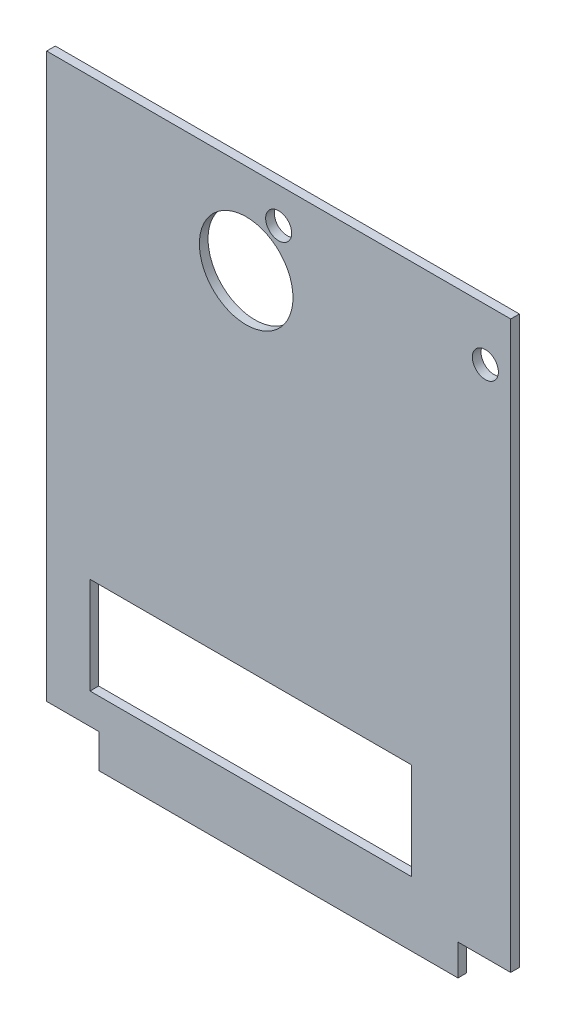
from build123d import *

# Parameters (mm, degrees)
SKETCH1_W           = 81.534
SKETCH1_H           = 104.902
BOSS_EXTRUDE1_DEPTH = 1.524
SKETCH2_W           = 9.17
SKETCH2_H           = 5.95
SKETCH2_W_2         = 9.266089767
SKETCH2_H_2         = 5.472
CUT_EXTRUDE1_DEPTH  = 1.524
SKETCH4_W           = 56.5
SKETCH4_H           = 17
CUT_EXTRUDE2_DEPTH  = 1.524
SKETCH6_R           = 2.285
CUT_EXTRUDE3_DEPTH  = 1.524
SKETCH8_R           = 8.224077239
CUT_EXTRUDE4_DEPTH  = 2.54


with BuildPart() as part:
    # Sketch1 → Boss-Extrude1 (new body)
    with BuildSketch(Plane.XY):
        with Locations((-2.046973799, -6.087681223)):
            Rectangle(SKETCH1_W, SKETCH1_H)
    extrude(amount=BOSS_EXTRUDE1_DEPTH)

    # Sketch2 → Cut-Extrude1 (cut)
    with BuildSketch(Plane.XY.offset(1.524)):
        with Locations((-38.228973799, -55.563681223)):
            Rectangle(SKETCH2_W, SKETCH2_H)
        with Locations((34.086981318, -55.802681223)):
            Rectangle(SKETCH2_W_2, SKETCH2_H_2)
    extrude(amount=-CUT_EXTRUDE1_DEPTH, mode=Mode.SUBTRACT)

    # Sketch4 → Cut-Extrude2 (cut)
    with BuildSketch(Plane.XY.offset(1.524)):
        with Locations((-6.933973799, -38.698681223)):
            Rectangle(SKETCH4_W, SKETCH4_H)
    extrude(amount=-CUT_EXTRUDE2_DEPTH, mode=Mode.SUBTRACT)

    # Sketch6 → Cut-Extrude3 (cut)
    with BuildSketch(Plane.XY.offset(1.524)):
        with Locations((-2.046973799, 40.158318777)):
            Circle(SKETCH6_R)
        with Locations((34.265026201, 37.193318777)):
            Circle(SKETCH6_R)
    extrude(amount=-CUT_EXTRUDE3_DEPTH, mode=Mode.SUBTRACT)

    # Sketch8 → Cut-Extrude4 (cut)
    with BuildSketch(Plane.XY.offset(1.524)):
        with Locations((-7.753098943, 30.457244975)):
            Circle(SKETCH8_R)
    extrude(amount=-CUT_EXTRUDE4_DEPTH, mode=Mode.SUBTRACT)


solid = part.part
